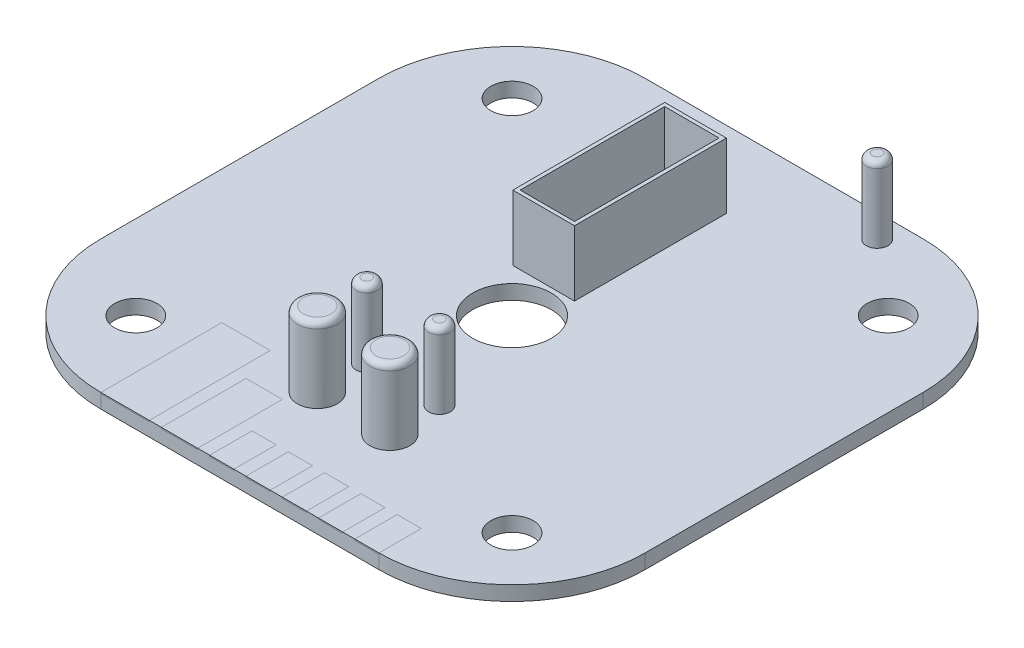
from build123d import *

# Parameters (mm, degrees)
SKETCH1_W               = 45
SKETCH1_H               = 45
BOSS_EXTRUDE1_DEPTH     = 0.6
CUT_EXTRUDE1_DEPTH      = 32.825461505
CUT_EXTRUDE1_DEPTH_BACK = 32.825461505
SKETCH3_R               = 3.25
FILLET1_R               = 11
CUT_EXTRUDE2_DEPTH      = 32.825461505
CUT_EXTRUDE2_DEPTH_BACK = 32.825461505
SKETCH5_R               = 1.75
SKETCH6_W               = 5.1
SKETCH6_H               = 12.56
SKETCH6_W_2             = 4.5
SKETCH6_H_2             = 11.96
EXTRUDE_THIN1_DEPTH     = 5.4
SKETCH7_W               = 4.5
SKETCH7_H               = 11.96
BOSS_EXTRUDE2_DEPTH     = 0.3
SKETCH8_W               = 2
SKETCH8_H               = 3.5
SKETCH8_W_2             = 4
SKETCH8_H_2             = 10
SKETCH8_W_3             = 3
SKETCH8_H_3             = 7
CUT_EXTRUDE3_DEPTH      = 0.1
SKETCH9_W               = 2
SKETCH9_H               = 3.5
BOSS_EXTRUDE3_DEPTH     = 0.1
BOSS_EXTRUDE3_2_DEPTH   = 0.1
BOSS_EXTRUDE3_3_DEPTH   = 0.1
BOSS_EXTRUDE3_4_DEPTH   = 0.1
BOSS_EXTRUDE3_5_DEPTH   = 0.1
SKETCH9_W_2             = 3
SKETCH9_H_2             = 7
BOSS_EXTRUDE3_6_DEPTH   = 0.1
SKETCH9_W_3             = 4
SKETCH9_H_3             = 10
BOSS_EXTRUDE3_7_DEPTH   = 0.1
SKETCH10_R              = 0.9
SKETCH10_R_2            = 1.65
BOSS_EXTRUDE4_DEPTH     = 6.2
FILLET2_R               = 0.5


with BuildPart() as part:
    # Sketch1 → Boss-Extrude1 (new, symmetric)
    with BuildSketch(Plane(origin=(0, 0, 0), x_dir=(1, 0, 0), z_dir=(0, 1, 0))):
        Rectangle(SKETCH1_W, SKETCH1_H)
    extrude(amount=BOSS_EXTRUDE1_DEPTH, both=True)

    # Sketch3 → Cut-Extrude1 (cut, two sides: drawn at the far end of the back side and taken through both)
    with BuildSketch(Plane(origin=(0, 0, 0), x_dir=(1, 0, 0), z_dir=(0, 1, 0)).offset(-CUT_EXTRUDE1_DEPTH_BACK)):
        with Locations(Location((0, 0, 0), (0, 0, 270))):
            Circle(SKETCH3_R)
    extrude(amount=CUT_EXTRUDE1_DEPTH + CUT_EXTRUDE1_DEPTH_BACK, mode=Mode.SUBTRACT)

    # Fillet1
    fillet1_edges = [part.edges().sort_by_distance(p)[0] for p in [
        (22.5, 0, 22.5),
        (-22.5, 0, 22.5),
        (-22.5, 0, -22.5),
        (22.5, 0, -22.5),
    ]]
    fillet(fillet1_edges, radius=FILLET1_R)

    # Sketch5 → Cut-Extrude2 (cut, two sides: drawn at the far end of the back side and taken through both)
    with BuildSketch(Plane(origin=(0, 0, 0), x_dir=(1, 0, 0), z_dir=(0, 1, 0)).offset(-CUT_EXTRUDE2_DEPTH_BACK)):
        with Locations(Location((-15.556349186, 15.556349186, 0), (0, 0, 270))):
            Circle(SKETCH5_R)
        with Locations(Location((15.556349186, 15.556349186, 0), (0, 0, 270))):
            Circle(SKETCH5_R)
        with Locations(Location((15.556349186, -15.556349186, 0), (0, 0, 270))):
            Circle(SKETCH5_R)
        with Locations(Location((-15.556349186, -15.556349186, 0), (0, 0, 270))):
            Circle(SKETCH5_R)
    extrude(amount=CUT_EXTRUDE2_DEPTH + CUT_EXTRUDE2_DEPTH_BACK, mode=Mode.SUBTRACT)

    # Sketch6 → Extrude-Thin1 (add)
    with BuildSketch(Plane(origin=(0, 0.6, 0), x_dir=(1, 0, 0), z_dir=(0, 1, 0))):
        with Locations((-1.006349186, 9.906349186)):
            Rectangle(SKETCH6_W, SKETCH6_H)
        with Locations((-1.006349186, 9.906349186)):
            Rectangle(SKETCH6_W_2, SKETCH6_H_2, mode=Mode.SUBTRACT)
    extrude(amount=EXTRUDE_THIN1_DEPTH)

    # Sketch7 → Boss-Extrude2 (add)
    with BuildSketch(Plane(origin=(0, 0.6, 0), x_dir=(1, 0, 0), z_dir=(0, 1, 0))):
        with Locations((-1.006349186, 9.906349186)):
            Rectangle(SKETCH7_W, SKETCH7_H)
    extrude(amount=BOSS_EXTRUDE2_DEPTH)

    # Sketch8 → Cut-Extrude3 (cut)
    with BuildSketch(Plane(origin=(0, 0.6, 0), x_dir=(1, 0, 0), z_dir=(0, 1, 0))):
        with Locations((-1.5, -20.75)):
            Rectangle(SKETCH8_W, SKETCH8_H)
        with Locations((1.5, -20.75)):
            Rectangle(SKETCH8_W, SKETCH8_H)
        with Locations((4.5, -20.75)):
            Rectangle(SKETCH8_W, SKETCH8_H)
        with Locations((7.5, -20.75)):
            Rectangle(SKETCH8_W, SKETCH8_H)
        with Locations((10.5, -20.75)):
            Rectangle(SKETCH8_W, SKETCH8_H)
        with Locations((-9.5, -17.5)):
            Rectangle(SKETCH8_W_2, SKETCH8_H_2)
        with Locations((-5, -19)):
            Rectangle(SKETCH8_W_3, SKETCH8_H_3)
    extrude(amount=-CUT_EXTRUDE3_DEPTH, mode=Mode.SUBTRACT)

    # Sketch10 → Boss-Extrude4 (add)
    with BuildSketch(Plane(origin=(0, 0.6, 0), x_dir=(1, 0, 0), z_dir=(0, 1, 0))):
        with Locations(Location((3.443650814, -9.443650814, 0), (0, 0, 90))):
            Circle(SKETCH10_R)
        with Locations(Location((3.443650814, -13.543650814, 0), (0, 0, 90))):
            Circle(SKETCH10_R_2)
        with Locations(Location((-2.556349186, -13.543650814, 0), (0, 0, 90))):
            Circle(SKETCH10_R_2)
        with Locations(Location((-2.556349186, -9.443650814, 0), (0, 0, 90))):
            Circle(SKETCH10_R)
        with Locations(Location((9.643650814, 20.556349186, 0), (0, 0, 90))):
            Circle(SKETCH10_R)
    extrude(amount=BOSS_EXTRUDE4_DEPTH)

    # Fillet2
    fillet2_edges = [part.edges().sort_by_distance(p)[0] for p in [
        (3.443650814, 6.8, 10.343650814),
        (3.443650814, 6.8, 15.193650814),
        (-2.556349186, 6.8, 15.193650814),
        (-2.556349186, 6.8, 10.343650814),
        (9.643650814, 6.8, -19.656349186),
    ]]
    fillet(fillet2_edges, radius=FILLET2_R)


with BuildPart() as body_2:
    # Sketch9 → Boss-Extrude3 (new body)
    with BuildSketch(Plane(origin=(0, 0.5, 0), x_dir=(1, 0, 0), z_dir=(0, 1, 0))):
        with Locations((10.5, -20.75)):
            Rectangle(SKETCH9_W, SKETCH9_H)
    extrude(amount=BOSS_EXTRUDE3_DEPTH)


with BuildPart() as body_3:
    # Sketch9 → Boss-Extrude3 2 (new body)
    with BuildSketch(Plane(origin=(0, 0.5, 0), x_dir=(1, 0, 0), z_dir=(0, 1, 0))):
        with Locations((7.5, -20.75)):
            Rectangle(SKETCH9_W, SKETCH9_H)
    extrude(amount=BOSS_EXTRUDE3_2_DEPTH)


with BuildPart() as body_4:
    # Sketch9 → Boss-Extrude3 3 (new body)
    with BuildSketch(Plane(origin=(0, 0.5, 0), x_dir=(1, 0, 0), z_dir=(0, 1, 0))):
        with Locations((4.5, -20.75)):
            Rectangle(SKETCH9_W, SKETCH9_H)
    extrude(amount=BOSS_EXTRUDE3_3_DEPTH)


with BuildPart() as body_5:
    # Sketch9 → Boss-Extrude3 4 (new body)
    with BuildSketch(Plane(origin=(0, 0.5, 0), x_dir=(1, 0, 0), z_dir=(0, 1, 0))):
        with Locations((1.5, -20.75)):
            Rectangle(SKETCH9_W, SKETCH9_H)
    extrude(amount=BOSS_EXTRUDE3_4_DEPTH)


with BuildPart() as body_6:
    # Sketch9 → Boss-Extrude3 5 (new body)
    with BuildSketch(Plane(origin=(0, 0.5, 0), x_dir=(1, 0, 0), z_dir=(0, 1, 0))):
        with Locations((-1.5, -20.75)):
            Rectangle(SKETCH9_W, SKETCH9_H)
    extrude(amount=BOSS_EXTRUDE3_5_DEPTH)


with BuildPart() as body_7:
    # Sketch9 → Boss-Extrude3 6 (new body)
    with BuildSketch(Plane(origin=(0, 0.5, 0), x_dir=(1, 0, 0), z_dir=(0, 1, 0))):
        with Locations((-5, -19)):
            Rectangle(SKETCH9_W_2, SKETCH9_H_2)
    extrude(amount=BOSS_EXTRUDE3_6_DEPTH)


with BuildPart() as body_8:
    # Sketch9 → Boss-Extrude3 7 (new body)
    with BuildSketch(Plane(origin=(0, 0.5, 0), x_dir=(1, 0, 0), z_dir=(0, 1, 0))):
        with Locations((-9.5, -17.5)):
            Rectangle(SKETCH9_W_3, SKETCH9_H_3)
    extrude(amount=BOSS_EXTRUDE3_7_DEPTH)


solid = Compound([part.part, body_2.part, body_3.part, body_4.part, body_5.part, body_6.part, body_7.part, body_8.part])
